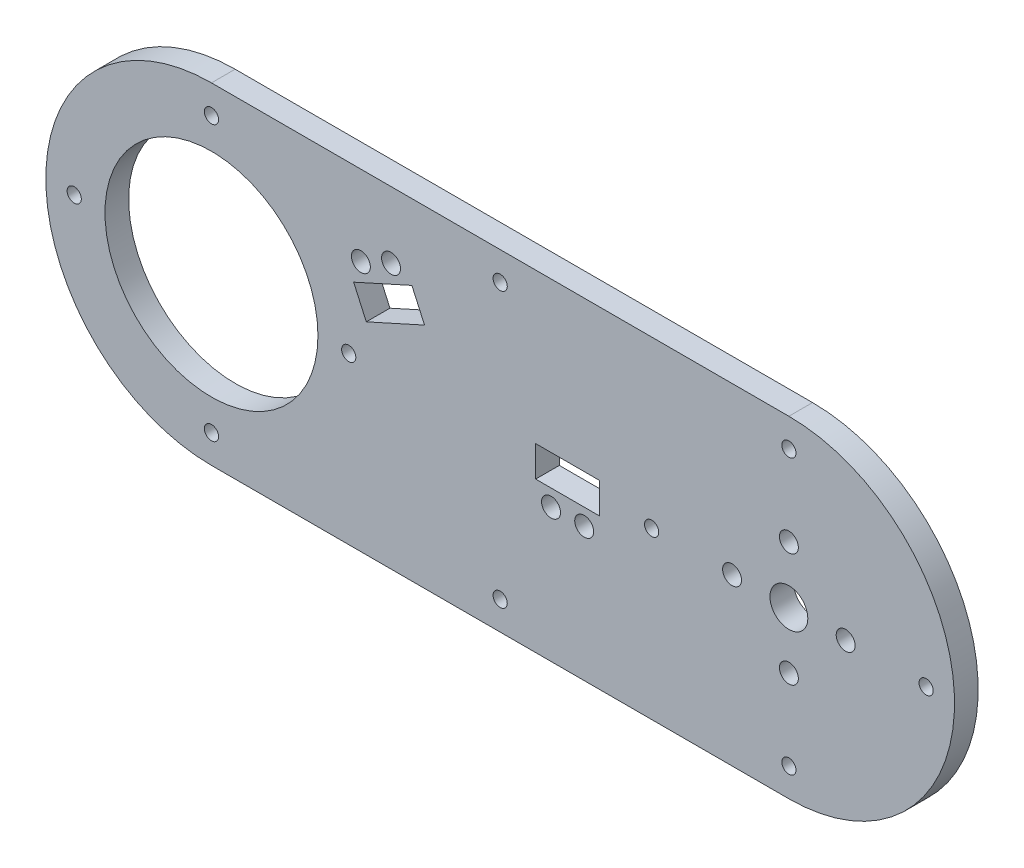
from build123d import *

# Parameters (mm, degrees)
SKETCH1_R           = 4
SKETCH1_R_2         = 22.5
SKETCH1_R_3         = 1.5
SKETCH1_R_4         = 2
SKETCH1_W           = 13.5
SKETCH1_H           = 6.5
BOSS_EXTRUDE1_DEPTH = 5


with BuildPart() as part:
    # Sketch1 → Boss-Extrude1 (new body)
    with BuildSketch(Plane.XY):
        with BuildLine():
            Line((61, -35), (-61, -35))
            ThreePointArc((-61, -35), (-96, 0), (-61, 35))
            Line((-61, 35), (61, 35))
            ThreePointArc((61, 35), (96, 0), (61, -35))
        make_face()
        with Locations((61, 0)):
            Circle(SKETCH1_R, mode=Mode.SUBTRACT)
        with Locations((-61, 0)):
            Circle(SKETCH1_R_2, mode=Mode.SUBTRACT)
        with Locations((-61, -29)):
            Circle(SKETCH1_R_3, mode=Mode.SUBTRACT)
        with Locations((-61, 29)):
            Circle(SKETCH1_R_3, mode=Mode.SUBTRACT)
        with Locations((61, 29)):
            Circle(SKETCH1_R_3, mode=Mode.SUBTRACT)
        with Locations((61, -29)):
            Circle(SKETCH1_R_3, mode=Mode.SUBTRACT)
        with Locations((0, 29)):
            Circle(SKETCH1_R_3, mode=Mode.SUBTRACT)
        with Locations((-90, 0)):
            Circle(SKETCH1_R_3, mode=Mode.SUBTRACT)
        with Locations((-32, 0)):
            Circle(SKETCH1_R_3, mode=Mode.SUBTRACT)
        with Locations((90, 0)):
            Circle(SKETCH1_R_3, mode=Mode.SUBTRACT)
        with Locations((32, 0)):
            Circle(SKETCH1_R_3, mode=Mode.SUBTRACT)
        with Locations((61, 12)):
            Circle(SKETCH1_R_4, mode=Mode.SUBTRACT)
        with Locations((61, -12)):
            Circle(SKETCH1_R_4, mode=Mode.SUBTRACT)
        with Locations((49, 0)):
            Circle(SKETCH1_R_4, mode=Mode.SUBTRACT)
        with Locations((73, 0)):
            Circle(SKETCH1_R_4, mode=Mode.SUBTRACT)
        with Locations((10.75, -6.75)):
            Circle(SKETCH1_R_4, mode=Mode.SUBTRACT)
        with Locations((17.75, -6.75)):
            Circle(SKETCH1_R_4, mode=Mode.SUBTRACT)
        with Locations((-23.054905042, 20.964824554)):
            Circle(SKETCH1_R_4, mode=Mode.SUBTRACT)
        with Locations((-29.435230641, 18.085337577)):
            Circle(SKETCH1_R_4, mode=Mode.SUBTRACT)
        with Locations((0, -29)):
            Circle(SKETCH1_R_3, mode=Mode.SUBTRACT)
        with Locations((14.25, 0)):
            Rectangle(SKETCH1_W, SKETCH1_H, mode=Mode.SUBTRACT)
        Polygon((-30.95778118, 13.55827011), (-28.283971844, 7.633682054), (-15.979058189, 13.186978367), (-18.652867525, 19.111566423), align=None, mode=Mode.SUBTRACT)
    extrude(amount=BOSS_EXTRUDE1_DEPTH)


solid = part.part
